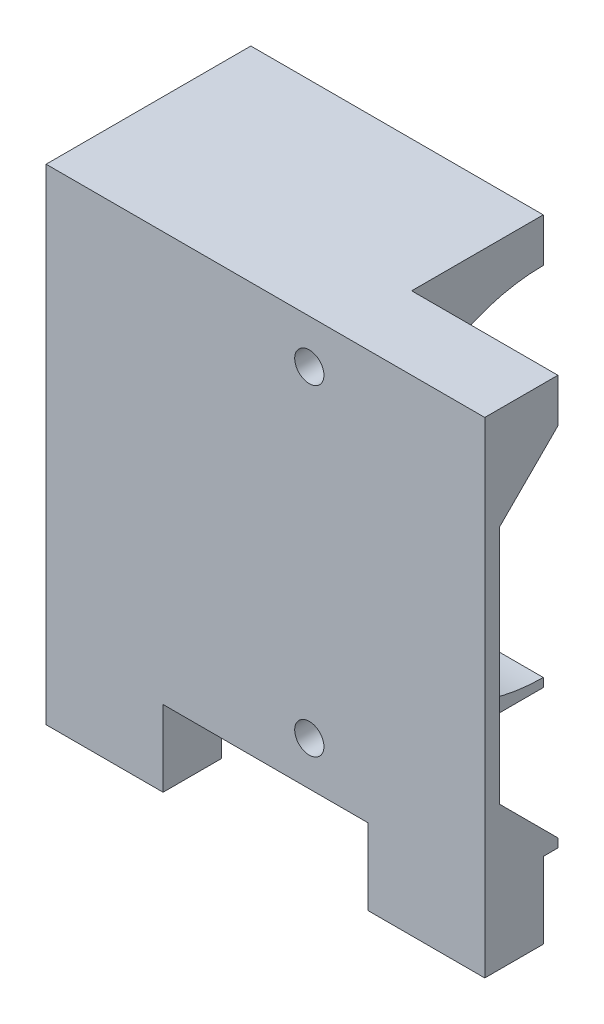
from build123d import *

# Parameters (mm, degrees)
EXTRUDE_1_DEPTH     = 20
SKETCH_2_W          = 1
SKETCH_2_H          = 24.4
EXTRUDE_2_DEPTH     = 10
EXTRUDE_4_DEPTH     = 0.6
EXTRUDE_5_DEPTH     = 10
SKETCH_8_W          = 8
SKETCH_8_H          = 4
EXTRUDE_6_DEPTH     = 5.2
EXTRUDE_7_DEPTH     = 3
SKETCH_3_R          = 1
CUT_EXTRUDE_1_DEPTH = 38.682887363
SKETCH_10_W         = 10
SKETCH_10_H         = 9
CUT_EXTRUDE_2_DEPTH = 3


with BuildPart() as part:
    # 草图1 → 凸台-拉伸1 (new body)
    with BuildSketch(Plane(origin=(0, 0, 0), x_dir=(0, 0, -1), z_dir=(1, 0, 0))):
        with BuildLine():
            Line((0, 12.2), (-14, 12.2))
            Line((-14, 12.2), (-14, -12.2))
            Line((-14, -12.2), (0, -12.2))
            ThreePointArc((0, -12.2), (-12.2, 0), (0, 12.2))
        make_face()
    extrude(amount=EXTRUDE_1_DEPTH)

    # 草图2 → 凸台-拉伸2 (add)
    with BuildSketch(Plane(origin=(20, 0, 0), x_dir=(0, 0, -1), z_dir=(1, 0, 0))):
        with Locations((-13.5, 0)):
            Rectangle(SKETCH_2_W, SKETCH_2_H)
    extrude(amount=EXTRUDE_2_DEPTH)

    # 草图6 → 凸台-拉伸4 (add)
    with BuildSketch(Plane.XZ.offset(12.2)):
        Polygon((0, 14), (0, 0), (20, 0), (20, 13), (30, 13), (30, 14), align=None)
    extrude(amount=EXTRUDE_4_DEPTH)

    # 草图7 → 凸台-拉伸5 (add)
    with BuildSketch(Plane(origin=(20, 0, 0), x_dir=(0, 0, -1), z_dir=(1, 0, 0))):
        Polygon((0, -12.2), (-9, -12.2), (-13, -8.2), (-13, -12.8), (0, -12.8), align=None)
        Polygon((-13, 8.2), (-9, 12.2), (-13, 12.2), align=None)
    extrude(amount=EXTRUDE_5_DEPTH)

    # 草图8 → 凸台-拉伸6 (add)
    with BuildSketch(Plane.XZ.offset(12.8)):
        with Locations((4, 12)):
            Rectangle(SKETCH_8_W, SKETCH_8_H)
        with Locations((26, 12)):
            Rectangle(SKETCH_8_W, SKETCH_8_H)
    extrude(amount=EXTRUDE_6_DEPTH)

    # 草图9 → 凸台-拉伸7 (add)
    with BuildSketch(Plane(origin=(0, 12.2, 0), x_dir=(1, 0, 0), z_dir=(0, 1, 0))):
        Polygon((0, 0), (20, 0), (20, -9), (30, -9), (30, -14), (0, -14), align=None)
    extrude(amount=EXTRUDE_7_DEPTH)

    # 草图3 → 切除-拉伸1 (cut, through all)
    with BuildSketch(Plane.XY.offset(14)):
        with Locations((18, 12.2)):
            Circle(SKETCH_3_R)
        with Locations((18, -9.8)):
            Circle(SKETCH_3_R)
    extrude(amount=-CUT_EXTRUDE_1_DEPTH, mode=Mode.SUBTRACT)

    # 草图10 → 切除-拉伸2 (cut)
    with BuildSketch(Plane(origin=(0, -12.2, 0), x_dir=(1, 0, 0), z_dir=(0, 1, 0))):
        with Locations((25, -4.5)):
            Rectangle(SKETCH_10_W, SKETCH_10_H)
    extrude(amount=-CUT_EXTRUDE_2_DEPTH, mode=Mode.SUBTRACT)


solid = part.part
